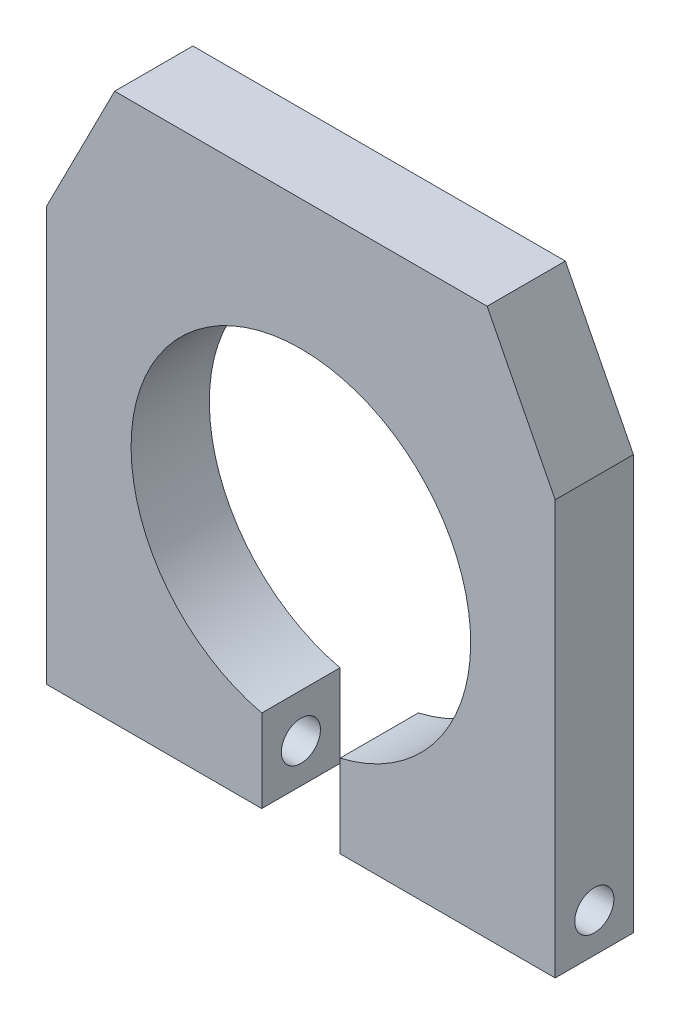
from build123d import *

# Parameters (mm, degrees)
BOSS_EXTRU_1_DEPTH      = 12.7
ESQUISSE2_R             = 3.175
ENL_V_MAT_EXTRU_1_DEPTH = 122.979516723
ENL_V_MAT_EXTRU_2_DEPTH = 122.979516723


with BuildPart() as part:
    # Esquisse1 → Boss.-Extru.1 (new body)
    with BuildSketch(Plane.XY):
        with BuildLine():
            Line((34.925, -88.9), (34.925, -75.458456647))
            ThreePointArc((34.925, -75.458456647), (41.275, -21.082), (47.625, -75.458456647))
            Line((47.625, -75.458456647), (47.625, -88.9))
            Line((47.625, -88.9), (82.55, -88.9))
            Line((82.55, -88.9), (82.55, 0))
            Line((82.55, 0), (0, 0))
            Line((0, 0), (0, -88.9))
            Line((0, -88.9), (34.925, -88.9))
        make_face()
    extrude(amount=BOSS_EXTRU_1_DEPTH)

    # Esquisse2 → Enlèv. mat.-Extru.1 (cut, through all)
    with BuildSketch(Plane(origin=(82.55, 0, 0), x_dir=(0, 0, -1), z_dir=(1, 0, 0))):
        with Locations(Location((-6.35, -82.55, 0), (0, 0, 90))):
            Circle(ESQUISSE2_R)
    extrude(amount=-ENL_V_MAT_EXTRU_1_DEPTH, mode=Mode.SUBTRACT)

    # Esquisse3 → Enlèv. mat.-Extru.2 (cut, through all)
    with BuildSketch(Plane.XY.offset(12.7)):
        Polygon((11.049, 0), (0, -21.684883475), (0, 0), align=None)
        Polygon((71.501, 0), (82.55, 0), (82.55, -21.684883475), align=None)
    extrude(amount=-ENL_V_MAT_EXTRU_2_DEPTH, mode=Mode.SUBTRACT)


solid = part.part
